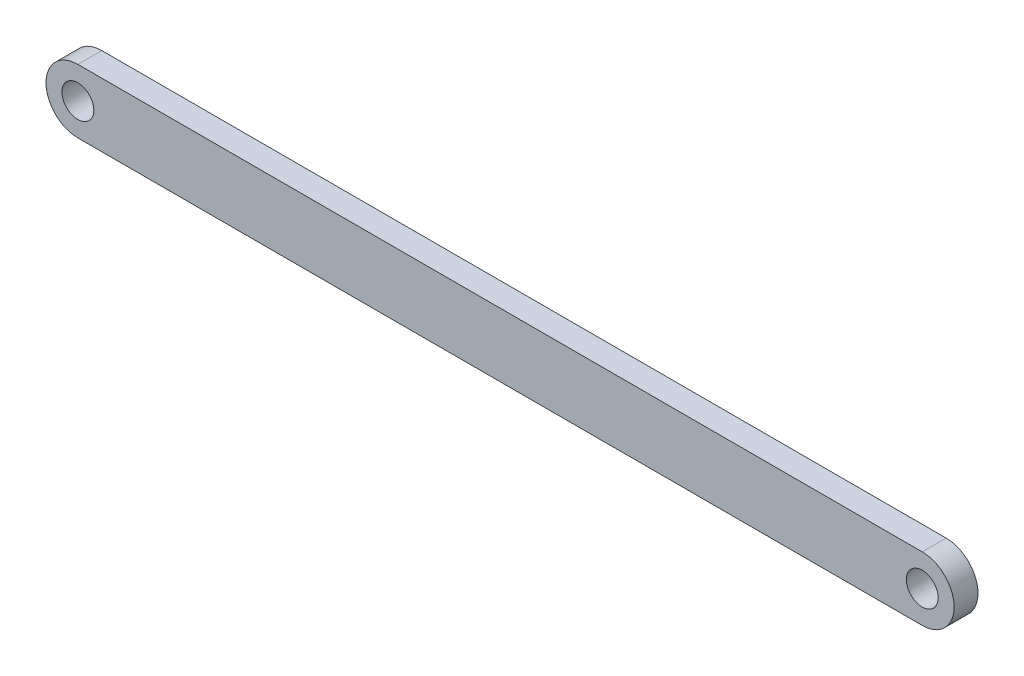
from build123d import *

# Parameters (mm, degrees)
SKETCH_1_R      = 4
EXTRUDE_1_DEPTH = 6


with BuildPart() as part:
    # 草图1 → 凸台-拉伸1 (new body)
    with BuildSketch(Plane.XY):
        with BuildLine():
            Line((-106, 8), (106, 8))
            ThreePointArc((106, 8), (114, 0), (106, -8))
            Line((106, -8), (-106, -8))
            ThreePointArc((-106, -8), (-114, 0), (-106, 8))
        make_face()
        with Locations((106, 0)):
            Circle(SKETCH_1_R, mode=Mode.SUBTRACT)
        with Locations((-106, 0)):
            Circle(SKETCH_1_R, mode=Mode.SUBTRACT)
    extrude(amount=EXTRUDE_1_DEPTH)


solid = part.part
